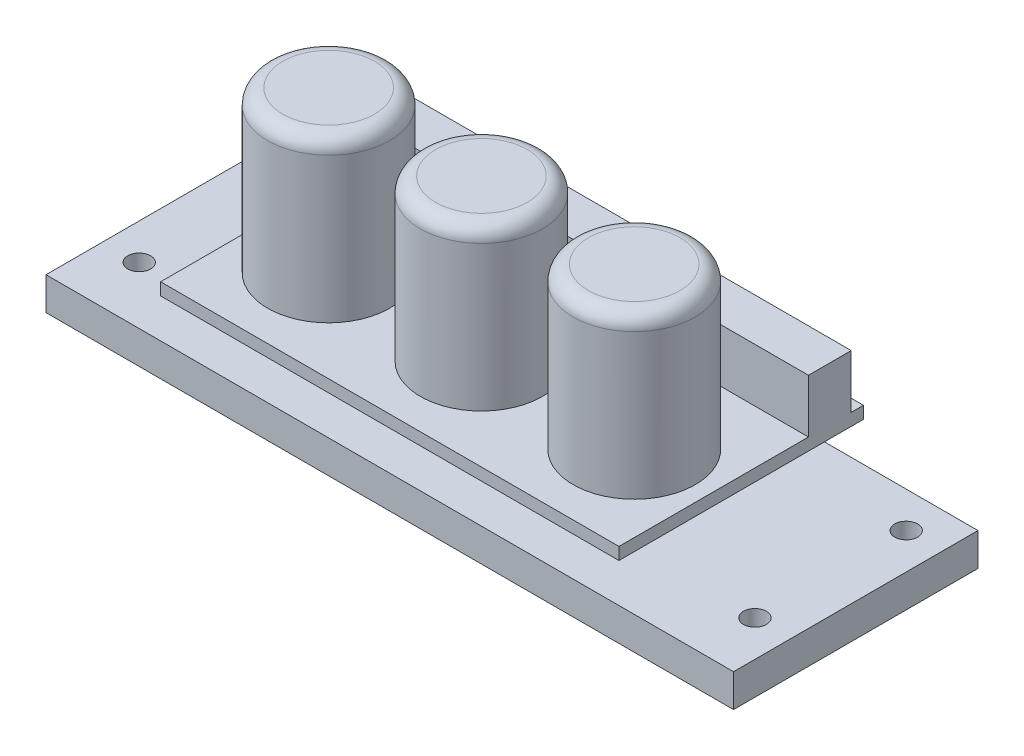
from build123d import *

# Parameters (mm, degrees)
SKETCH2_W                = 90
SKETCH2_H                = 32
SKETCH2_R                = 1.5
BOSS_EXTRUDE1_DEPTH      = 4.3
SKETCH3_W                = 60
SKETCH3_H                = 32
BOSS_EXTRUDE2_DEPTH      = 1.6
SKETCH4_R                = 8
BOSS_EXTRUDE3_DEPTH      = 21
FILLET1_R                = 2
BOSS_EXTRUDE4_DEPTH      = 30
BOSS_EXTRUDE4_DEPTH_BACK = 30
SKETCH5_W                = 5.6
SKETCH5_H                = 7


with BuildPart() as part:
    # Sketch2 → Boss-Extrude1 (new body)
    with BuildSketch(Plane(origin=(0, 0, 0), x_dir=(1, 0, 0), z_dir=(0, 1, 0))):
        Rectangle(SKETCH2_W, SKETCH2_H)
        with Locations(Location((40.3, 11.3, 0), (0, 0, 90))):
            Circle(SKETCH2_R, mode=Mode.SUBTRACT)
        with Locations(Location((40.3, -8.5, 0), (0, 0, 90))):
            Circle(SKETCH2_R, mode=Mode.SUBTRACT)
        with Locations(Location((-40.3, -8.5, 0), (0, 0, 90))):
            Circle(SKETCH2_R, mode=Mode.SUBTRACT)
        with Locations(Location((-40.3, 11.3, 0), (0, 0, 90))):
            Circle(SKETCH2_R, mode=Mode.SUBTRACT)
    extrude(amount=BOSS_EXTRUDE1_DEPTH)


with BuildPart() as body_2:
    # Sketch3 → Boss-Extrude2 (new body)
    with BuildSketch(Plane(origin=(0, 9.4, 0), x_dir=(1, 0, 0), z_dir=(0, 1, 0))):
        Rectangle(SKETCH3_W, SKETCH3_H)
    extrude(amount=BOSS_EXTRUDE2_DEPTH)

    # Sketch4 → Boss-Extrude3 (add)
    with BuildSketch(Plane(origin=(0, 11, 0), x_dir=(1, 0, 0), z_dir=(0, 1, 0))):
        with Locations(Location((20, -4, 0), (0, 0, 90))):
            Circle(SKETCH4_R)
        with Locations(Location((0, -4, 0), (0, 0, 90))):
            Circle(SKETCH4_R)
        with Locations(Location((-20, -4, 0), (0, 0, 90))):
            Circle(SKETCH4_R)
    extrude(amount=BOSS_EXTRUDE3_DEPTH)

    # Fillet1
    fillet1_edges = [body_2.edges().sort_by_distance(p)[0] for p in [
        (20, 32, 12),
        (-20, 32, 12),
        (0, 32, 12),
    ]]
    fillet(fillet1_edges, radius=FILLET1_R)

    # Sketch5 → Boss-Extrude4 (add, two sides: drawn at the far end of the back side and taken through both)
    with BuildSketch(Plane(origin=(0, 0, 0), x_dir=(0, 0, -1), z_dir=(1, 0, 0)).offset(-BOSS_EXTRUDE4_DEPTH_BACK)):
        with Locations((11.607185034, 14.5)):
            Rectangle(SKETCH5_W, SKETCH5_H)
    extrude(amount=BOSS_EXTRUDE4_DEPTH + BOSS_EXTRUDE4_DEPTH_BACK)


solid = Compound([part.part, body_2.part])
